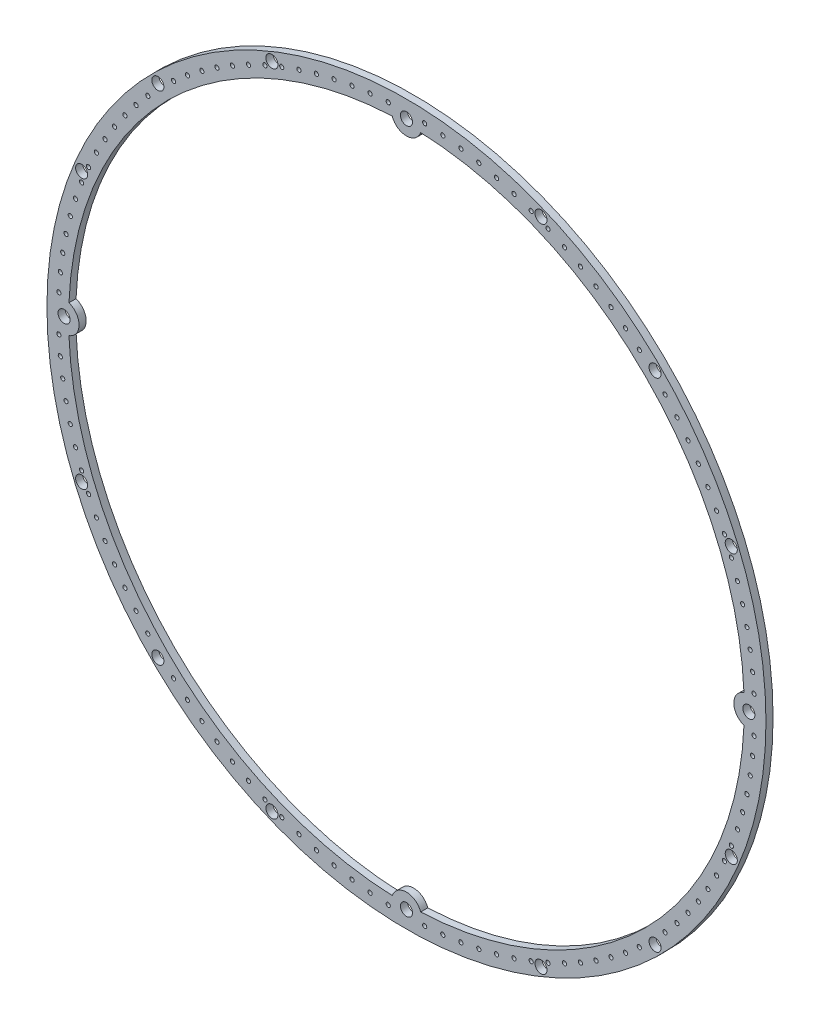
from build123d import *

# Parameters (mm, degrees)
SKETCH1_R           = 128.5748
SKETCH1_R_2         = 0.75
SKETCH1_R_3         = 2.159
BOSS_EXTRUDE1_DEPTH = 2.54


with BuildPart() as part:
    # Sketch1 → Boss-Extrude1 (new body)
    with BuildSketch(Plane.XY):
        Circle(SKETCH1_R)
        with Locations((-73.1557525, -100.69025512)):
            Circle(SKETCH1_R_2, mode=Mode.SUBTRACT)
        with Locations((-78.32521587, -96.723586363)):
            Circle(SKETCH1_R_2, mode=Mode.SUBTRACT)
        with Locations((-67.785774298, -104.380938886)):
            Circle(SKETCH1_R_2, mode=Mode.SUBTRACT)
        with Locations((-96.723586363, -78.32521587)):
            Circle(SKETCH1_R_2, mode=Mode.SUBTRACT)
        with Locations((-100.69025512, -73.1557525)):
            Circle(SKETCH1_R_2, mode=Mode.SUBTRACT)
        with Locations((-104.380938886, -67.785774298)):
            Circle(SKETCH1_R_2, mode=Mode.SUBTRACT)
        with Locations((-88.904535599, -88.904535599)):
            Circle(SKETCH1_R_3, mode=Mode.SUBTRACT)
        with Locations((-83.279995267, -92.491804979)):
            Circle(SKETCH1_R_2, mode=Mode.SUBTRACT)
        with Locations((-92.491804979, -83.279995267)):
            Circle(SKETCH1_R_2, mode=Mode.SUBTRACT)
        with Locations((-50.622442597, -113.699867658)):
            Circle(SKETCH1_R_2, mode=Mode.SUBTRACT)
        with Locations((-48.114787951, -116.159373623)):
            Circle(SKETCH1_R_3, mode=Mode.SUBTRACT)
        with Locations((-44.602475, -116.193419882)):
            Circle(SKETCH1_R_2, mode=Mode.SUBTRACT)
        with Locations((-38.46025512, -118.368494018)):
            Circle(SKETCH1_R_2, mode=Mode.SUBTRACT)
        with Locations((-32.212618353, -120.21912834)):
            Circle(SKETCH1_R_2, mode=Mode.SUBTRACT)
        with Locations((-56.503657598, -110.894672)):
            Circle(SKETCH1_R_2, mode=Mode.SUBTRACT)
        with Locations((-62.23, -107.785521755)):
            Circle(SKETCH1_R_2, mode=Mode.SUBTRACT)
        with Locations((-25.876689039, -121.740250387)):
            Circle(SKETCH1_R_2, mode=Mode.SUBTRACT)
        with Locations((-19.469833519, -122.92769087)):
            Circle(SKETCH1_R_2, mode=Mode.SUBTRACT)
        with Locations((-13.009612538, -123.778195098)):
            Circle(SKETCH1_R_2, mode=Mode.SUBTRACT)
        with Locations((-6.513733114, -124.289431896)):
            Circle(SKETCH1_R_2, mode=Mode.SUBTRACT)
        with Locations((-113.699867658, -50.622442597)):
            Circle(SKETCH1_R_2, mode=Mode.SUBTRACT)
        with Locations((-107.785521755, -62.23)):
            Circle(SKETCH1_R_2, mode=Mode.SUBTRACT)
        with Locations((-110.894672, -56.503657598)):
            Circle(SKETCH1_R_2, mode=Mode.SUBTRACT)
        with Locations((-116.159373623, -48.114787951)):
            Circle(SKETCH1_R_3, mode=Mode.SUBTRACT)
        with Locations((-116.193419882, -44.602475)):
            Circle(SKETCH1_R_2, mode=Mode.SUBTRACT)
        with Locations((-118.368494018, -38.46025512)):
            Circle(SKETCH1_R_2, mode=Mode.SUBTRACT)
        with Locations((-120.21912834, -32.212618353)):
            Circle(SKETCH1_R_2, mode=Mode.SUBTRACT)
        with Locations((-121.740250387, -25.876689039)):
            Circle(SKETCH1_R_2, mode=Mode.SUBTRACT)
        with Locations((-122.92769087, -19.469833519)):
            Circle(SKETCH1_R_2, mode=Mode.SUBTRACT)
        with Locations((-123.778195098, -13.009612538)):
            Circle(SKETCH1_R_2, mode=Mode.SUBTRACT)
        with Locations((-124.289431896, -6.513733114)):
            Circle(SKETCH1_R_2, mode=Mode.SUBTRACT)
        with Locations((6.513733114, -124.289431896)):
            Circle(SKETCH1_R_2, mode=Mode.SUBTRACT)
        with Locations((13.009612538, -123.778195098)):
            Circle(SKETCH1_R_2, mode=Mode.SUBTRACT)
        with Locations((19.469833519, -122.92769087)):
            Circle(SKETCH1_R_2, mode=Mode.SUBTRACT)
        with Locations((25.876689039, -121.740250387)):
            Circle(SKETCH1_R_2, mode=Mode.SUBTRACT)
        with Locations((32.212618353, -120.21912834)):
            Circle(SKETCH1_R_2, mode=Mode.SUBTRACT)
        with Locations((38.46025512, -118.368494018)):
            Circle(SKETCH1_R_2, mode=Mode.SUBTRACT)
        with Locations((44.602475, -116.193419882)):
            Circle(SKETCH1_R_2, mode=Mode.SUBTRACT)
        with Locations((48.114787951, -116.159373623)):
            Circle(SKETCH1_R_3, mode=Mode.SUBTRACT)
        with Locations((50.622442597, -113.699867658)):
            Circle(SKETCH1_R_2, mode=Mode.SUBTRACT)
        with Locations((56.503657598, -110.894672)):
            Circle(SKETCH1_R_2, mode=Mode.SUBTRACT)
        with Locations((62.23, -107.785521755)):
            Circle(SKETCH1_R_2, mode=Mode.SUBTRACT)
        with Locations((67.785774298, -104.380938886)):
            Circle(SKETCH1_R_2, mode=Mode.SUBTRACT)
        with Locations((73.1557525, -100.69025512)):
            Circle(SKETCH1_R_2, mode=Mode.SUBTRACT)
        with Locations((78.32521587, -96.723586363)):
            Circle(SKETCH1_R_2, mode=Mode.SUBTRACT)
        with Locations((83.279995267, -92.491804979)):
            Circle(SKETCH1_R_2, mode=Mode.SUBTRACT)
        with Locations((88.904535599, -88.904535599)):
            Circle(SKETCH1_R_3, mode=Mode.SUBTRACT)
        with Locations((92.491804979, -83.279995267)):
            Circle(SKETCH1_R_2, mode=Mode.SUBTRACT)
        with Locations((96.723586363, -78.32521587)):
            Circle(SKETCH1_R_2, mode=Mode.SUBTRACT)
        with Locations((100.69025512, -73.1557525)):
            Circle(SKETCH1_R_2, mode=Mode.SUBTRACT)
        with Locations((104.380938886, -67.785774298)):
            Circle(SKETCH1_R_2, mode=Mode.SUBTRACT)
        with Locations((107.785521755, -62.23)):
            Circle(SKETCH1_R_2, mode=Mode.SUBTRACT)
        with Locations((110.894672, -56.503657598)):
            Circle(SKETCH1_R_2, mode=Mode.SUBTRACT)
        with Locations((113.699867658, -50.622442597)):
            Circle(SKETCH1_R_2, mode=Mode.SUBTRACT)
        with Locations((116.159373623, -48.114787951)):
            Circle(SKETCH1_R_3, mode=Mode.SUBTRACT)
        with Locations((116.193419882, -44.602475)):
            Circle(SKETCH1_R_2, mode=Mode.SUBTRACT)
        with Locations((118.368494018, -38.46025512)):
            Circle(SKETCH1_R_2, mode=Mode.SUBTRACT)
        with Locations((120.21912834, -32.212618353)):
            Circle(SKETCH1_R_2, mode=Mode.SUBTRACT)
        with Locations((121.740250387, -25.876689039)):
            Circle(SKETCH1_R_2, mode=Mode.SUBTRACT)
        with Locations((122.92769087, -19.469833519)):
            Circle(SKETCH1_R_2, mode=Mode.SUBTRACT)
        with Locations((123.778195098, -13.009612538)):
            Circle(SKETCH1_R_2, mode=Mode.SUBTRACT)
        with Locations((124.289431896, -6.513733114)):
            Circle(SKETCH1_R_2, mode=Mode.SUBTRACT)
        with Locations((-124.289431896, 6.513733114)):
            Circle(SKETCH1_R_2, mode=Mode.SUBTRACT)
        with Locations((-123.778195098, 13.009612538)):
            Circle(SKETCH1_R_2, mode=Mode.SUBTRACT)
        with Locations((-122.92769087, 19.469833519)):
            Circle(SKETCH1_R_2, mode=Mode.SUBTRACT)
        with Locations((-121.740250387, 25.876689039)):
            Circle(SKETCH1_R_2, mode=Mode.SUBTRACT)
        with Locations((-120.21912834, 32.212618353)):
            Circle(SKETCH1_R_2, mode=Mode.SUBTRACT)
        with Locations((-118.368494018, 38.46025512)):
            Circle(SKETCH1_R_2, mode=Mode.SUBTRACT)
        with Locations((-116.193419882, 44.602475)):
            Circle(SKETCH1_R_2, mode=Mode.SUBTRACT)
        with Locations((-116.159373623, 48.114787951)):
            Circle(SKETCH1_R_3, mode=Mode.SUBTRACT)
        with Locations((-113.699867658, 50.622442597)):
            Circle(SKETCH1_R_2, mode=Mode.SUBTRACT)
        with Locations((-110.894672, 56.503657598)):
            Circle(SKETCH1_R_2, mode=Mode.SUBTRACT)
        with Locations((-107.785521755, 62.23)):
            Circle(SKETCH1_R_2, mode=Mode.SUBTRACT)
        with Locations((-104.380938886, 67.785774298)):
            Circle(SKETCH1_R_2, mode=Mode.SUBTRACT)
        with Locations((-100.69025512, 73.1557525)):
            Circle(SKETCH1_R_2, mode=Mode.SUBTRACT)
        with Locations((-96.723586363, 78.32521587)):
            Circle(SKETCH1_R_2, mode=Mode.SUBTRACT)
        with Locations((-92.491804979, 83.279995267)):
            Circle(SKETCH1_R_2, mode=Mode.SUBTRACT)
        with Locations((-88.904535599, 88.904535599)):
            Circle(SKETCH1_R_3, mode=Mode.SUBTRACT)
        with Locations((-83.279995267, 92.491804979)):
            Circle(SKETCH1_R_2, mode=Mode.SUBTRACT)
        with Locations((-78.32521587, 96.723586363)):
            Circle(SKETCH1_R_2, mode=Mode.SUBTRACT)
        with Locations((-73.1557525, 100.69025512)):
            Circle(SKETCH1_R_2, mode=Mode.SUBTRACT)
        with Locations((-67.785774298, 104.380938886)):
            Circle(SKETCH1_R_2, mode=Mode.SUBTRACT)
        with Locations((-62.23, 107.785521755)):
            Circle(SKETCH1_R_2, mode=Mode.SUBTRACT)
        with Locations((-56.503657598, 110.894672)):
            Circle(SKETCH1_R_2, mode=Mode.SUBTRACT)
        with Locations((-50.622442597, 113.699867658)):
            Circle(SKETCH1_R_2, mode=Mode.SUBTRACT)
        with Locations((-48.114787951, 116.159373623)):
            Circle(SKETCH1_R_3, mode=Mode.SUBTRACT)
        with Locations((-44.602475, 116.193419882)):
            Circle(SKETCH1_R_2, mode=Mode.SUBTRACT)
        with Locations((-38.46025512, 118.368494018)):
            Circle(SKETCH1_R_2, mode=Mode.SUBTRACT)
        with Locations((-32.212618353, 120.21912834)):
            Circle(SKETCH1_R_2, mode=Mode.SUBTRACT)
        with Locations((-25.876689039, 121.740250387)):
            Circle(SKETCH1_R_2, mode=Mode.SUBTRACT)
        with Locations((-19.469833519, 122.92769087)):
            Circle(SKETCH1_R_2, mode=Mode.SUBTRACT)
        with Locations((-13.009612538, 123.778195098)):
            Circle(SKETCH1_R_2, mode=Mode.SUBTRACT)
        with Locations((-6.513733114, 124.289431896)):
            Circle(SKETCH1_R_2, mode=Mode.SUBTRACT)
        with BuildLine():
            ThreePointArc((120.700624787, 5.08), (117.079516772, 0), (120.700624787, -5.08))
            ThreePointArc((120.700624787, -5.08), (85.423788326, -85.423788326), (5.08, -120.700624787))
            ThreePointArc((5.08, -120.700624787), (0, -117.079516772), (-5.08, -120.700624787))
            ThreePointArc((-5.08, -120.700624787), (-85.423788326, -85.423788326), (-120.700624787, -5.08))
            ThreePointArc((-120.700624787, -5.08), (-117.079516772, 0), (-120.700624787, 5.08))
            ThreePointArc((-120.700624787, 5.08), (-85.423788326, 85.423788326), (-5.08, 120.700624787))
            ThreePointArc((-5.08, 120.700624787), (0, 117.079516772), (5.08, 120.700624787))
            ThreePointArc((5.08, 120.700624787), (85.423788326, 85.423788326), (120.700624787, 5.08))
        make_face(mode=Mode.SUBTRACT)
        with Locations((-122.4534, 0)):
            Circle(SKETCH1_R_3, mode=Mode.SUBTRACT)
        with Locations((0, -122.4534)):
            Circle(SKETCH1_R_3, mode=Mode.SUBTRACT)
        with Locations((0, 122.4534)):
            Circle(SKETCH1_R_3, mode=Mode.SUBTRACT)
        with Locations((122.4534, 0)):
            Circle(SKETCH1_R_3, mode=Mode.SUBTRACT)
        with Locations((124.289431896, 6.513733114)):
            Circle(SKETCH1_R_2, mode=Mode.SUBTRACT)
        with Locations((123.778195098, 13.009612538)):
            Circle(SKETCH1_R_2, mode=Mode.SUBTRACT)
        with Locations((122.92769087, 19.469833519)):
            Circle(SKETCH1_R_2, mode=Mode.SUBTRACT)
        with Locations((121.740250387, 25.876689039)):
            Circle(SKETCH1_R_2, mode=Mode.SUBTRACT)
        with Locations((120.21912834, 32.212618353)):
            Circle(SKETCH1_R_2, mode=Mode.SUBTRACT)
        with Locations((118.368494018, 38.46025512)):
            Circle(SKETCH1_R_2, mode=Mode.SUBTRACT)
        with Locations((116.193419882, 44.602475)):
            Circle(SKETCH1_R_2, mode=Mode.SUBTRACT)
        with Locations((116.159373623, 48.114787951)):
            Circle(SKETCH1_R_3, mode=Mode.SUBTRACT)
        with Locations((110.894672, 56.503657598)):
            Circle(SKETCH1_R_2, mode=Mode.SUBTRACT)
        with Locations((107.785521755, 62.23)):
            Circle(SKETCH1_R_2, mode=Mode.SUBTRACT)
        with Locations((113.699867658, 50.622442597)):
            Circle(SKETCH1_R_2, mode=Mode.SUBTRACT)
        with Locations((6.513733114, 124.289431896)):
            Circle(SKETCH1_R_2, mode=Mode.SUBTRACT)
        with Locations((13.009612538, 123.778195098)):
            Circle(SKETCH1_R_2, mode=Mode.SUBTRACT)
        with Locations((19.469833519, 122.92769087)):
            Circle(SKETCH1_R_2, mode=Mode.SUBTRACT)
        with Locations((25.876689039, 121.740250387)):
            Circle(SKETCH1_R_2, mode=Mode.SUBTRACT)
        with Locations((62.23, 107.785521755)):
            Circle(SKETCH1_R_2, mode=Mode.SUBTRACT)
        with Locations((56.503657598, 110.894672)):
            Circle(SKETCH1_R_2, mode=Mode.SUBTRACT)
        with Locations((32.212618353, 120.21912834)):
            Circle(SKETCH1_R_2, mode=Mode.SUBTRACT)
        with Locations((38.46025512, 118.368494018)):
            Circle(SKETCH1_R_2, mode=Mode.SUBTRACT)
        with Locations((44.602475, 116.193419882)):
            Circle(SKETCH1_R_2, mode=Mode.SUBTRACT)
        with Locations((48.114787951, 116.159373623)):
            Circle(SKETCH1_R_3, mode=Mode.SUBTRACT)
        with Locations((50.622442597, 113.699867658)):
            Circle(SKETCH1_R_2, mode=Mode.SUBTRACT)
        with Locations((92.491804979, 83.279995267)):
            Circle(SKETCH1_R_2, mode=Mode.SUBTRACT)
        with Locations((83.279995267, 92.491804979)):
            Circle(SKETCH1_R_2, mode=Mode.SUBTRACT)
        with Locations((88.904535599, 88.904535599)):
            Circle(SKETCH1_R_3, mode=Mode.SUBTRACT)
        with Locations((104.380938886, 67.785774298)):
            Circle(SKETCH1_R_2, mode=Mode.SUBTRACT)
        with Locations((100.69025512, 73.1557525)):
            Circle(SKETCH1_R_2, mode=Mode.SUBTRACT)
        with Locations((96.723586363, 78.32521587)):
            Circle(SKETCH1_R_2, mode=Mode.SUBTRACT)
        with Locations((67.785774298, 104.380938886)):
            Circle(SKETCH1_R_2, mode=Mode.SUBTRACT)
        with Locations((78.32521587, 96.723586363)):
            Circle(SKETCH1_R_2, mode=Mode.SUBTRACT)
        with Locations((73.1557525, 100.69025512)):
            Circle(SKETCH1_R_2, mode=Mode.SUBTRACT)
    extrude(amount=BOSS_EXTRUDE1_DEPTH)


solid = part.part
